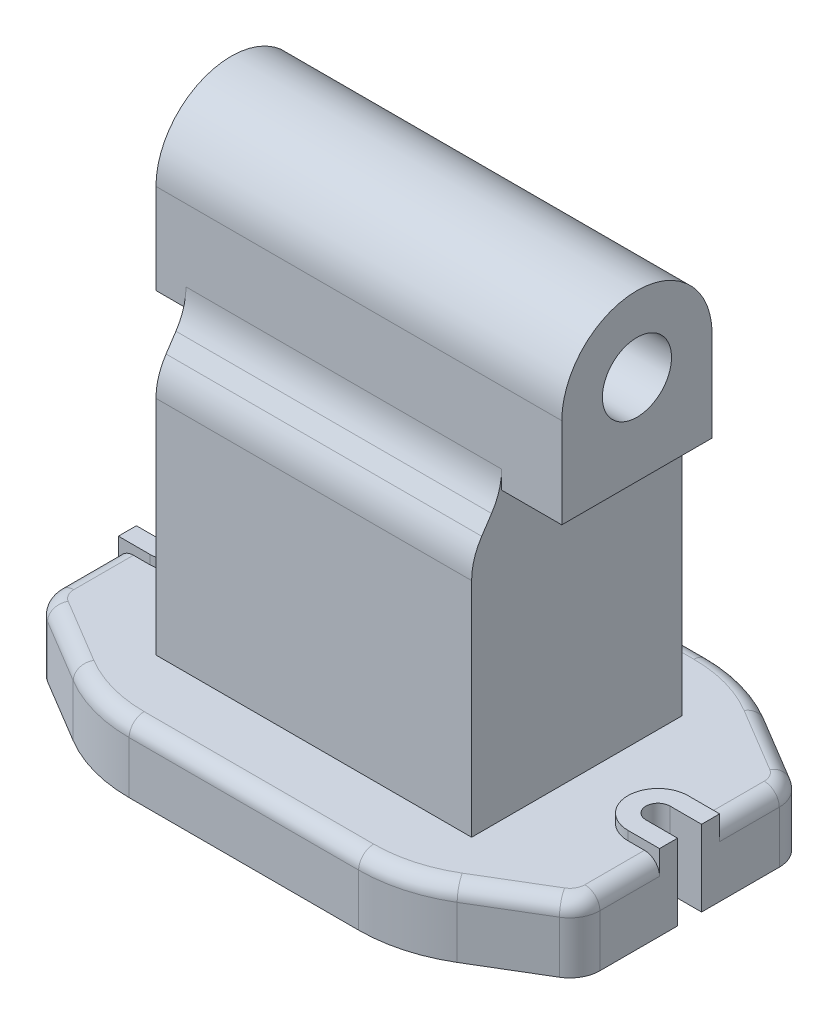
from build123d import *

# Parameters (mm, degrees)
BASE_DEPTH                    = 22.3
RESALTO_FUROS_DE_FIXA_O_DEPTH = 3
SKETCH4_W                     = 105
SKETCH4_H                     = 70
CORPO_RETANGULAR_DEPTH        = 80
CORPO_INCLINADO_DEPTH         = 105
SKETCH5_4_R                   = 11.5
CORPO_ARREDONDADO_BACK_DEPTH  = 10
SKETCH5_5_R                   = 11.5
CORPO_ARREDONDADO_FRONT_DEPTH = 125
SKETCH9_R                     = 4
PINOS_GUIA_DEPTH              = 20
RAIOS_50MM_R                  = 50
RAIOS_20MM_R                  = 20
RAIOS_10MM_R                  = 10
RAIOS_5MM_R                   = 5
FURO_M10X50_D                 = 9
FURO_M10X50_DEPTH             = 47.296127214
FURO_M10X50_TIP               = 2.703872786


with BuildPart() as part:
    # Sketch1 → Base (new body)
    with BuildSketch(Plane(origin=(0, 0, 0), x_dir=(1, 0, 0), z_dir=(0, 1, 0))):
        with BuildLine():
            Line((-27.5, 54.25), (-38, 54.25))
            Line((-38, 54.25), (-38, 22.75))
            Line((-38, 22.75), (0, 0))
            Line((0, 0), (104, 0))
            Line((104, 0), (142, 22.75))
            Line((142, 22.75), (142, 54.25))
            Line((142, 54.25), (131.5, 54.25))
            ThreePointArc((131.5, 54.25), (127.5, 58.25), (131.5, 62.25))
            Line((131.5, 62.25), (142, 62.25))
            Line((142, 62.25), (142, 93.75))
            Line((142, 93.75), (104, 116.5))
            Line((104, 116.5), (0, 116.5))
            Line((0, 116.5), (-38, 93.75))
            Line((-38, 93.75), (-38, 62.25))
            Line((-38, 62.25), (-27.5, 62.25))
            ThreePointArc((-27.5, 62.25), (-23.5, 58.25), (-27.5, 54.25))
        make_face()
    extrude(amount=BASE_DEPTH)

    # Sketch3 → Resalto - Furos de Fixação (add)
    with BuildSketch(Plane(origin=(0, 22.3, 0), x_dir=(1, 0, 0), z_dir=(0, 1, 0))):
        with BuildLine():
            Line((-27.5, 54.25), (-38, 54.25))
            Line((-38, 54.25), (-38, 48.25))
            Line((-38, 48.25), (-27.5, 48.25))
            ThreePointArc((-27.5, 48.25), (-17.5, 58.25), (-27.5, 68.25))
            Line((-27.5, 68.25), (-38, 68.25))
            Line((-38, 68.25), (-38, 62.25))
            Line((-38, 62.25), (-27.5, 62.25))
            ThreePointArc((-27.5, 62.25), (-23.5, 58.25), (-27.5, 54.25))
        make_face()
        with BuildLine():
            Line((142, 54.25), (142, 48.25))
            Line((142, 48.25), (131.5, 48.25))
            ThreePointArc((131.5, 48.25), (121.5, 58.25), (131.5, 68.25))
            Line((131.5, 68.25), (142, 68.25))
            Line((142, 68.25), (142, 62.25))
            Line((142, 62.25), (131.5, 62.25))
            ThreePointArc((131.5, 62.25), (127.5, 58.25), (131.5, 54.25))
            Line((131.5, 54.25), (142, 54.25))
        make_face()
    extrude(amount=RESALTO_FUROS_DE_FIXA_O_DEPTH)

    # Sketch4 → Corpo Retangular (add)
    with BuildSketch(Plane(origin=(0, 22.3, 0), x_dir=(1, 0, 0), z_dir=(0, 1, 0))):
        with Locations((52, 58.25)):
            Rectangle(SKETCH4_W, SKETCH4_H)
    extrude(amount=CORPO_RETANGULAR_DEPTH)

    # Sketch5 → Corpo Inclinado (add)
    with BuildSketch(Plane.ZY.offset(0.5)):
        Polygon((-33.25, 117.3), (-83.25, 117.3), (-93.25, 102.3), (-23.25, 102.3), align=None)
    extrude(amount=-CORPO_INCLINADO_DEPTH)



with BuildPart() as body_2:
    # Sketch5<4> → Corpo Arredondado - Back (new body)
    with BuildSketch(Plane.ZY.offset(0.5)):
        with BuildLine():
            Line((-33.25, 117.3), (-33.25, 147.3))
            ThreePointArc((-33.25, 147.3), (-58.25, 172.3), (-83.25, 147.3))
            Line((-83.25, 147.3), (-83.25, 117.3))
            Line((-83.25, 117.3), (-33.25, 117.3))
        make_face()
        with Locations((-58.25, 147.3)):
            Circle(SKETCH5_4_R, mode=Mode.SUBTRACT)
    extrude(amount=CORPO_ARREDONDADO_BACK_DEPTH)


with BuildPart() as part_1:
    add(part.part)

    add(body_2.part)  # Corpo Arredondado - Front merges body 2
    # Sketch5<5> → Corpo Arredondado - Front (add)
    with BuildSketch(Plane.ZY.offset(0.5)):
        with BuildLine():
            Line((-33.25, 117.3), (-33.25, 147.3))
            ThreePointArc((-33.25, 147.3), (-58.25, 172.3), (-83.25, 147.3))
            Line((-83.25, 147.3), (-83.25, 117.3))
            Line((-83.25, 117.3), (-33.25, 117.3))
        make_face()
        with Locations((-58.25, 147.3)):
            Circle(SKETCH5_5_R, mode=Mode.SUBTRACT)
    extrude(amount=-CORPO_ARREDONDADO_FRONT_DEPTH)

    # Sketch9 → Pinos Guia (add)
    with BuildSketch(Plane.XZ):
        with Locations((2.5, -58.25)):
            Circle(SKETCH9_R)
        with Locations((101.5, -58.25)):
            Circle(SKETCH9_R)
    extrude(amount=PINOS_GUIA_DEPTH)

    # Raios 50mm
    raios_50mm_edges = [part_1.edges().sort_by_distance(p)[0] for p in [
        (0, 11.15, -116.5),
        (104, 11.15, -116.5),
        (0, 11.15, 0),
        (104, 11.15, 0),
    ]]
    fillet(raios_50mm_edges, radius=RAIOS_50MM_R)

    # Raios 20mm
    raios_20mm_edges = [part_1.edges().sort_by_distance(p)[0] for p in [
        (52, 102.3, -93.25),
        (52, 117.3, -83.25),
        (52, 117.3, -33.25),
        (52, 102.3, -23.25),
    ]]
    fillet(raios_20mm_edges, radius=RAIOS_20MM_R)

    # Raios 10mm
    raios_10mm_edges = [part_1.edges().sort_by_distance(p)[0] for p in [
        (-38, 11.15, -93.75),
        (-38, 11.15, -22.75),
        (142, 11.15, -93.75),
        (142, 11.15, -22.75),
    ]]
    fillet(raios_10mm_edges, radius=RAIOS_10MM_R)

    # Raios 5mm
    raios_5mm_edges = [part_1.edges().sort_by_distance(p)[0] for p in [
        (142, 22.3, -78.165851268),
        (140.699613253, 22.3, -93.01290211),
        (126.498390623, 22.3, -103.030568772),
        (103.500210672, 22.3, -114.692200918),
        (-38, 22.3, -78.165851268),
        (-36.699613253, 22.3, -93.01290211),
        (-22.498390623, 22.3, -103.030568772),
        (0.499789328, 22.3, -114.692200918),
        (-38, 22.3, -38.334148732),
        (-36.699613253, 22.3, -23.48709789),
        (-22.498390623, 22.3, -13.469431228),
        (0.499789328, 22.3, -1.807799082),
        (142, 22.3, -38.334148732),
        (140.699613253, 22.3, -23.48709789),
        (126.498390623, 22.3, -13.469431228),
        (103.500210672, 22.3, -1.807799082),
        (52, 22.3, -116.5),
        (52, 22.3, 0),
    ]]
    fillet(raios_5mm_edges, radius=RAIOS_5MM_R)

    # Furo M10x50
    with Locations(Plane.ZY.offset(0.5)):
        with Locations((-58.25, 97.3)):
            Hole(FURO_M10X50_D / 2, depth=FURO_M10X50_DEPTH)
            with Locations((0, 0, -(FURO_M10X50_DEPTH + FURO_M10X50_TIP / 2))):  # 118° drill point
                Cone(0, FURO_M10X50_D / 2, FURO_M10X50_TIP, mode=Mode.SUBTRACT)


solid = part_1.part
